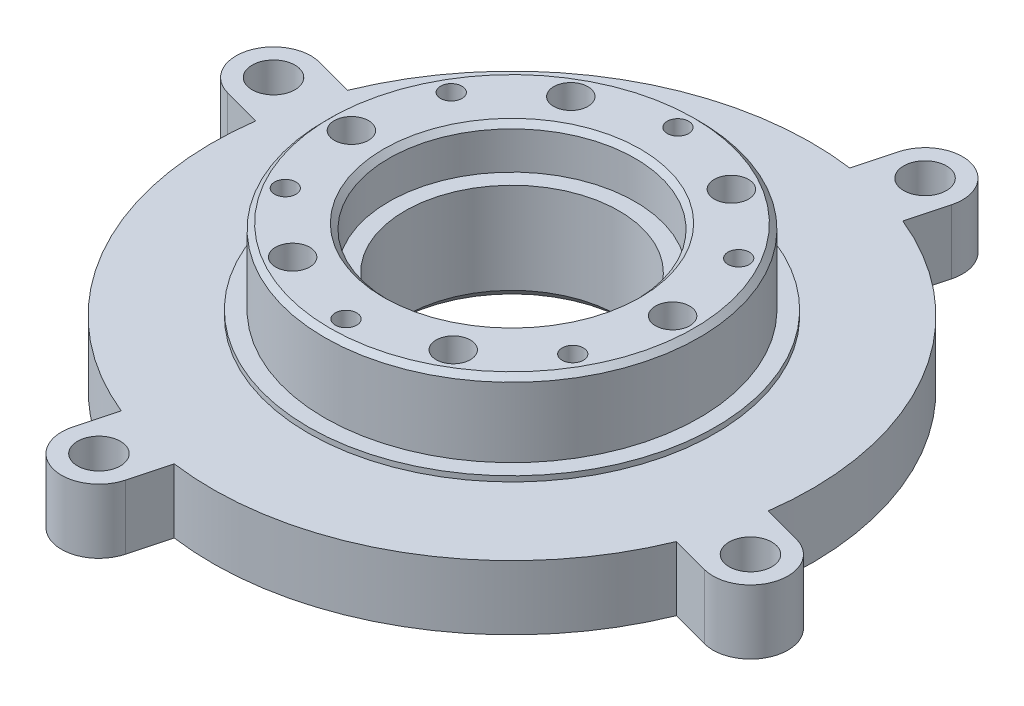
from build123d import *

# Parameters (mm, degrees)
SKETCH1_R           = 28
BOSS_EXTRUDE1_DEPTH = 6
SKETCH2_R           = 19
BOSS_EXTRUDE2_DEPTH = 0.5
SKETCH3_R           = 17.5
BOSS_EXTRUDE3_DEPTH = 7
SKETCH4_R           = 1
CUT_EXTRUDE1_DEPTH  = 3
CIRPATTERN1_COUNT   = 6
SKETCH5_R           = 11.5
CUT_EXTRUDE2_DEPTH  = 4
SKETCH6_R           = 10
CUT_EXTRUDE3_DEPTH  = 9.5
SKETCH7_R           = 1.6
CUT_EXTRUDE4_DEPTH  = 13.5
SKETCH9_R           = 3.5
CUT_EXTRUDE10_DEPTH = 5
SKETCH10_R          = 2
CUT_EXTRUDE11_DEPTH = 11
CIRPATTERN2_COUNT   = 6
CHAMFER1_SIZE       = 1
CHAMFER2_SIZE       = 0.5
SKETCH13_R          = 1.6
BOSS_EXTRUDE4_DEPTH = 6
SKETCH14_R          = 2
CUT_EXTRUDE12_DEPTH = 4
CIRPATTERN3_COUNT   = 4


with BuildPart() as part:
    # Sketch1 → Boss-Extrude1 (new body)
    with BuildSketch(Plane(origin=(0, 0, 0), x_dir=(1, 0, 0), z_dir=(0, 1, 0))):
        with Locations(Location((0, 0, 0), (0, 0, 270))):
            Circle(SKETCH1_R)
    extrude(amount=BOSS_EXTRUDE1_DEPTH)

    # Sketch2 → Boss-Extrude2 (add)
    with BuildSketch(Plane(origin=(0, 6, 0), x_dir=(1, 0, 0), z_dir=(0, 1, 0))):
        with Locations(Location((0, 0, 0), (0, 0, 270))):
            Circle(SKETCH2_R)
    extrude(amount=BOSS_EXTRUDE2_DEPTH)

    # Sketch3 → Boss-Extrude3 (add)
    with BuildSketch(Plane(origin=(0, 6.5, 0), x_dir=(1, 0, 0), z_dir=(0, 1, 0))):
        with Locations(Location((0, 0, 0), (0, 0, 270))):
            Circle(SKETCH3_R)
    extrude(amount=BOSS_EXTRUDE3_DEPTH)

    # Sketch4 → Cut-Extrude1 (cut)
    with BuildSketch(Plane(origin=(0, 13.5, 0), x_dir=(1, 0, 0), z_dir=(0, 1, 0))):
        with Locations(Location((0, 15.5, 0), (0, 0, 270))):
            Circle(SKETCH4_R)
    cut_extrude1 = extrude(amount=-CUT_EXTRUDE1_DEPTH, mode=Mode.SUBTRACT)

    # CirPattern1: Cut-Extrude1 ×6 about axis
    cirpattern1_axis = Axis((0, 0, 0), (0, 1, 0))
    for i in range(1, CIRPATTERN1_COUNT):
        add(cut_extrude1.rotate(cirpattern1_axis, i * 360 / CIRPATTERN1_COUNT), mode=Mode.SUBTRACT)

    # Sketch5 → Cut-Extrude2 (cut)
    with BuildSketch(Plane(origin=(0, 13.5, 0), x_dir=(1, 0, 0), z_dir=(0, 1, 0))):
        with Locations(Location((0, 0, 0), (0, 0, 270))):
            Circle(SKETCH5_R)
    extrude(amount=-CUT_EXTRUDE2_DEPTH, mode=Mode.SUBTRACT)

    # Sketch6 → Cut-Extrude3 (cut)
    with BuildSketch(Plane(origin=(0, 9.5, 0), x_dir=(1, 0, 0), z_dir=(0, 1, 0))):
        with Locations(Location((0, 0, 0), (0, 0, 270))):
            Circle(SKETCH6_R)
    extrude(amount=-CUT_EXTRUDE3_DEPTH, mode=Mode.SUBTRACT)

    # Sketch7 → Cut-Extrude4 (cut)
    with BuildSketch(Plane(origin=(0, 13.5, 0), x_dir=(1, 0, 0), z_dir=(0, 1, 0))):
        with Locations(Location((7.5, 12.990381057, 0), (0, 0, 270))):
            Circle(SKETCH7_R)
    cut_extrude4 = extrude(amount=-CUT_EXTRUDE4_DEPTH, mode=Mode.SUBTRACT)

    # Sketch9 → Cut-Extrude10 (cut)
    with BuildSketch(Plane.XZ):
        with Locations(Location((7.5, -12.990381057, 0), (0, 0, 270))):
            Circle(SKETCH9_R)
    cut_extrude10 = extrude(amount=-CUT_EXTRUDE10_DEPTH, mode=Mode.SUBTRACT)

    # Sketch10 → Cut-Extrude11 (cut)
    with BuildSketch(Plane.XZ):
        with Locations(Location((7.5, -12.990381057, 0), (0, 0, 270))):
            Circle(SKETCH10_R)
    cut_extrude11 = extrude(amount=-CUT_EXTRUDE11_DEPTH, mode=Mode.SUBTRACT)

    # CirPattern2: Cut-Extrude4, Cut-Extrude10, Cut-Extrude11 ×6 about axis
    cirpattern2_axis = Axis((0, 0, 0), (0, 1, 0))
    add([cut_extrude4.rotate(cirpattern2_axis, i * 360 / CIRPATTERN2_COUNT) for i in range(1, CIRPATTERN2_COUNT)], mode=Mode.SUBTRACT)
    add([cut_extrude10.rotate(cirpattern2_axis, i * 360 / CIRPATTERN2_COUNT) for i in range(1, CIRPATTERN2_COUNT)], mode=Mode.SUBTRACT)
    add([cut_extrude11.rotate(cirpattern2_axis, i * 360 / CIRPATTERN2_COUNT) for i in range(1, CIRPATTERN2_COUNT)], mode=Mode.SUBTRACT)

    # Chamfer1
    chamfer1_edges = [part.edges().sort_by_distance(p)[0] for p in [
        (0, 0, -10),
    ]]
    chamfer(chamfer1_edges, length=CHAMFER1_SIZE)

    # Chamfer2
    chamfer2_edges = [part.edges().sort_by_distance(p)[0] for p in [
        (0, 13.5, -17.5),
        (0, 13.5, -11.5),
    ]]
    chamfer(chamfer2_edges, length=CHAMFER2_SIZE)

    # Sketch13 → Boss-Extrude4 (add)
    with BuildSketch(Plane(origin=(0, 6, 0), x_dir=(1, 0, 0), z_dir=(0, 1, 0))):
        with BuildLine():
            Line((4.772059529, 31.332530186), (3.027664457, 24.822359149))
            Line((3.027664457, 24.822359149), (9.789145241, 23.010625833))
            Line((9.789145241, 23.010625833), (11.533540313, 29.52079687))
            ThreePointArc((11.533540313, 29.52079687), (9.058666579, 33.80740392), (4.772059529, 31.332530186))
        make_face()
        with Locations(Location((8.152799921, 30.426663528, 0), (0, 0, 270))):
            Circle(SKETCH13_R, mode=Mode.SUBTRACT)
    boss_extrude4 = extrude(amount=-BOSS_EXTRUDE4_DEPTH)

    # Sketch14 → Cut-Extrude12 (cut)
    with BuildSketch(Plane(origin=(0, 6, 0), x_dir=(1, 0, 0), z_dir=(0, 1, 0))):
        with Locations(Location((8.152799921, 30.426663528, 0), (0, 0, 270))):
            Circle(SKETCH14_R)
    cut_extrude12 = extrude(amount=-CUT_EXTRUDE12_DEPTH, mode=Mode.SUBTRACT)

    # CirPattern3: Boss-Extrude4, Cut-Extrude12 ×4 about axis
    cirpattern3_axis = Axis((0, 0, 0), (0, 1, 0))
    add([boss_extrude4.rotate(cirpattern3_axis, i * 360 / CIRPATTERN3_COUNT) for i in range(1, CIRPATTERN3_COUNT)])
    add([cut_extrude12.rotate(cirpattern3_axis, i * 360 / CIRPATTERN3_COUNT) for i in range(1, CIRPATTERN3_COUNT)], mode=Mode.SUBTRACT)


solid = part.part
